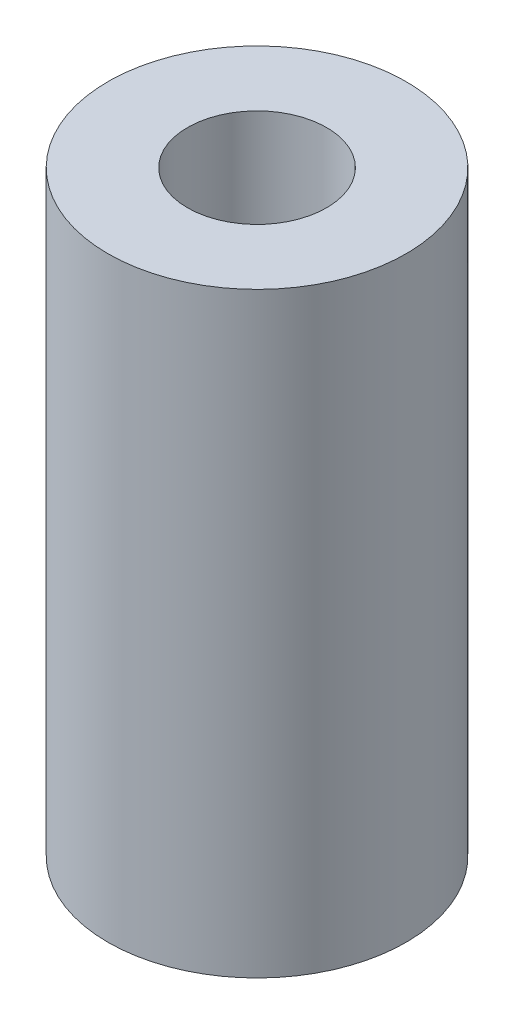
from build123d import *

# Parameters (mm, degrees)
ESQUISSE1_R        = 3
ESQUISSE1_R_2      = 1.4
BOSS_EXTRU_1_DEPTH = 12


with BuildPart() as part:
    # Esquisse1 → Boss.-Extru.1 (new body)
    with BuildSketch(Plane(origin=(0, 0, 0), x_dir=(1, 0, 0), z_dir=(0, 1, 0))):
        with Locations(Location((0, 0, 0), (0, 0, 270))):
            Circle(ESQUISSE1_R)
        with Locations(Location((0, 0, 0), (0, 0, 270))):
            Circle(ESQUISSE1_R_2, mode=Mode.SUBTRACT)
    extrude(amount=BOSS_EXTRU_1_DEPTH)


solid = part.part
